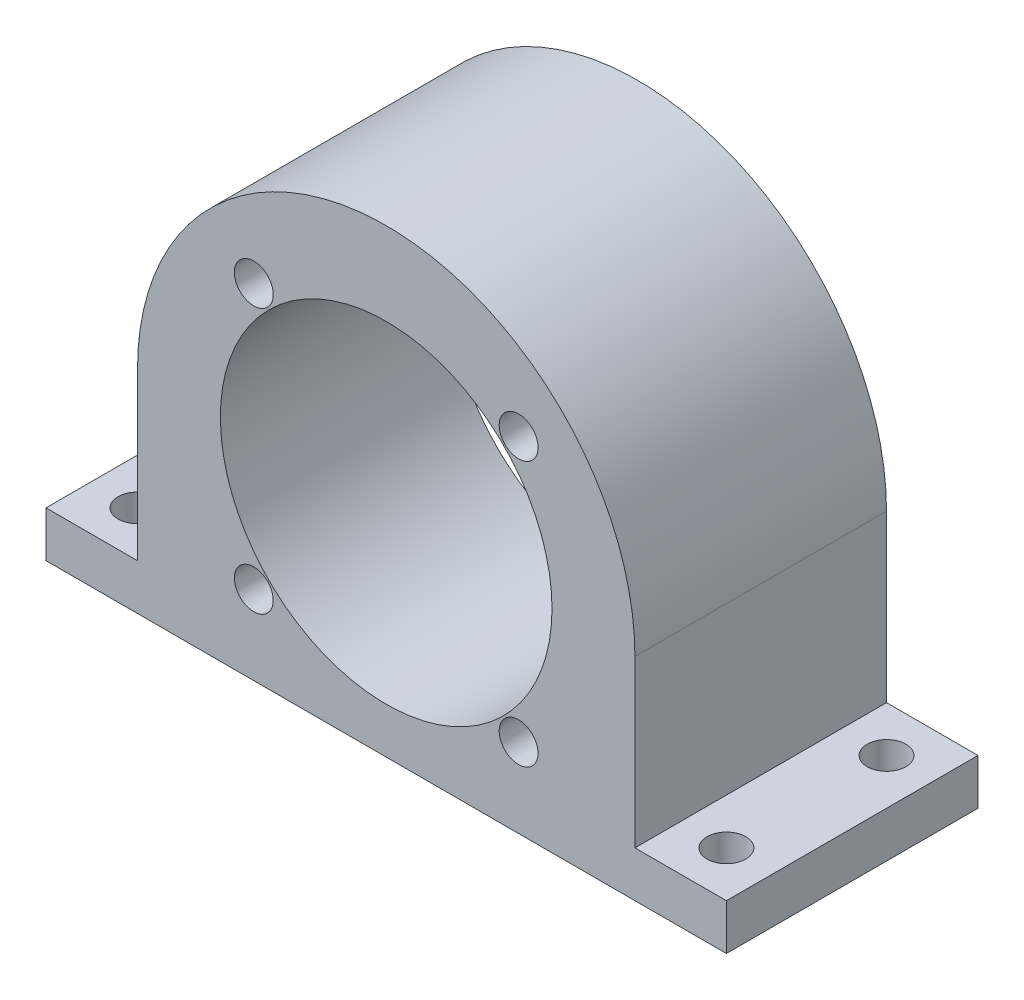
from build123d import *

# Parameters (mm, degrees)
SKETCH2_R                       = 14.5
BOSS_EXTRUDE1_DEPTH             = 11
SKETCH4_W                       = 8
SKETCH4_H                       = 4
BOSS_EXTRUDE2_DEPTH             = 8
M3_CLEARANCE_HOLE1_D            = 3.4
MIRROR2_COPY_1_SKETCH_W         = 8
MIRROR2_COPY_1_SKETCH_H         = 4
MIRROR2_COPY_1_DEPTH            = 8
MIRROR2_COPY_2_D                = 3.4
CUT_EXTRUDE1_DEPTH              = 2
M3_CLEARANCE_HOLE2_D            = 3.4
CIRPATTERN1_COUNT               = 4
BOSS_EXTRUDE3_REACH             = 53.246
SKETCH11_W                      = 6
SKETCH11_H                      = 4
BOSS_EXTRUDE3_DIRECTION_2_REACH = 53.246


with BuildPart() as part:
    # Sketch2 → Boss-Extrude1 (new, symmetric)
    with BuildSketch(Plane.XY):
        with BuildLine():
            Line((-21.75, 0), (21.75, 0))
            Line((21.75, 0), (21.75, 18.5))
            ThreePointArc((21.75, 18.5), (0, 40.25), (-21.75, 18.5))
            Line((-21.75, 18.5), (-21.75, 0))
        make_face()
        with Locations((0, 18.5)):
            Circle(SKETCH2_R, mode=Mode.SUBTRACT)
    extrude(amount=BOSS_EXTRUDE1_DEPTH, both=True)

    # Sketch4 → Boss-Extrude2 (add)
    with BuildSketch(Plane.ZY.offset(21.75)):
        with Locations((-7, 2)):
            Rectangle(SKETCH4_W, SKETCH4_H)
    boss_extrude2 = extrude(amount=BOSS_EXTRUDE2_DEPTH)

    # M3 Clearance Hole1 (through all)
    with Locations(Plane(origin=(0, 4, 0), x_dir=(1, 0, 0), z_dir=(0, 1, 0))):
        with Locations((-25.75, 7)):
            m3_clearance_hole1 = Hole(M3_CLEARANCE_HOLE1_D / 2)

    # Mirror1: Boss-Extrude2, M3 Clearance Hole1 across plane
    add(boss_extrude2.mirror(Plane.XY))
    add(m3_clearance_hole1.mirror(Plane.XY), mode=Mode.SUBTRACT)

    # Mirror2: Boss-Extrude2, M3 Clearance Hole1 across plane
    add(boss_extrude2.mirror(Plane(origin=(0, 0, 0), x_dir=(0, 0, 1), z_dir=(1, 0, 0))))
    add(m3_clearance_hole1.mirror(Plane(origin=(0, 0, 0), x_dir=(0, 0, 1), z_dir=(1, 0, 0))), mode=Mode.SUBTRACT)

    # Mirror2 copy 1 sketch → Mirror2 copy 1 (add)
    with BuildSketch(Plane(origin=(21.75, 0, 0), x_dir=(0, 0, -1), z_dir=(1, 0, 0))):
        with Locations((-7, 2)):
            Rectangle(MIRROR2_COPY_1_SKETCH_W, MIRROR2_COPY_1_SKETCH_H)
    extrude(amount=MIRROR2_COPY_1_DEPTH)

    # Mirror2 copy 2 (through all)
    with Locations(Plane(origin=(0, 4, 0), x_dir=(-1, 0, 0), z_dir=(0, 1, 0))):
        with Locations((-25.75, 7)):
            Hole(MIRROR2_COPY_2_D / 2)

    # Sketch8 → Cut-Extrude1 (cut)
    with BuildSketch(Plane(origin=(0, 0, -11), x_dir=(-1, 0, 0), z_dir=(0, 0, -1))):
        with BuildLine():
            Line((-14.318912319, 27.338834765), (-12.620179844, 25.64010229))
            ThreePointArc((-12.620179844, 25.64010229), (-10.253048327, 28.753048327), (-7.14010229, 31.120179844))
            Line((-7.14010229, 31.120179844), (-8.838834765, 32.818912319))
            ThreePointArc((-8.838834765, 32.818912319), (-14.318912319, 32.818912319), (-14.318912319, 27.338834765))
        make_face()
    cut_extrude1 = extrude(amount=-CUT_EXTRUDE1_DEPTH, mode=Mode.SUBTRACT)

    # M3 Clearance Hole2 (through all)
    with Locations(Plane(origin=(0, 0, -9), x_dir=(-1, 0, 0), z_dir=(0, 0, -1))):
        with Locations((-11.578873542, 30.078873542)):
            m3_clearance_hole2 = Hole(M3_CLEARANCE_HOLE2_D / 2)

    # CirPattern1: Cut-Extrude1, M3 Clearance Hole2 ×4 about axis
    cirpattern1_axis = Axis((0, 18.5, 0), (0, 0, 1))
    add([cut_extrude1.rotate(cirpattern1_axis, i * 360 / CIRPATTERN1_COUNT) for i in range(1, CIRPATTERN1_COUNT)], mode=Mode.SUBTRACT)
    add([m3_clearance_hole2.rotate(cirpattern1_axis, i * 360 / CIRPATTERN1_COUNT) for i in range(1, CIRPATTERN1_COUNT)], mode=Mode.SUBTRACT)

    # Boss-Extrude3: up to this face of the body (flat: up to its plane)
    boss_extrude3_end = Plane(part.part.faces().sort_by_distance((29.75, 2, 7))[0])
    # Sketch11 → Boss-Extrude3 (add, up to the picked face)
    with BuildSketch(Plane(origin=(0, 0, 0), x_dir=(0, 0, -1), z_dir=(1, 0, 0)), mode=Mode.PRIVATE) as boss_extrude3_sk1:
        with Locations((0, 2)):
            Rectangle(SKETCH11_W, SKETCH11_H)
    boss_extrude3_tool1 = split(extrude(boss_extrude3_sk1.sketch, amount=BOSS_EXTRUDE3_REACH, mode=Mode.PRIVATE), bisect_by=boss_extrude3_end, keep=Keep.BOTH, mode=Mode.PRIVATE)
    add(boss_extrude3_tool1.solids().sort_by(Axis((0, 2, 0), (1, 0, 0)))[0])

    # Boss-Extrude3 direction 2: up to this face of the body (flat: up to its plane)
    boss_extrude3_direction_2_end = Plane(part.part.faces().sort_by_distance((-29.75, 2, 7))[0])
    # Sketch11 → Boss-Extrude3 direction 2 (add, up to the picked face)
    with BuildSketch(Plane(origin=(0, 0, 0), x_dir=(0, 0, -1), z_dir=(1, 0, 0)), mode=Mode.PRIVATE) as boss_extrude3_direction_2_sk1:
        with Locations((0, 2)):
            Rectangle(SKETCH11_W, SKETCH11_H)
    boss_extrude3_direction_2_tool1 = split(extrude(boss_extrude3_direction_2_sk1.sketch, amount=-BOSS_EXTRUDE3_DIRECTION_2_REACH, mode=Mode.PRIVATE), bisect_by=boss_extrude3_direction_2_end, keep=Keep.BOTH, mode=Mode.PRIVATE)
    add(boss_extrude3_direction_2_tool1.solids().sort_by(Axis((0, 2, 0), (-1, 0, 0)))[0])


solid = part.part
